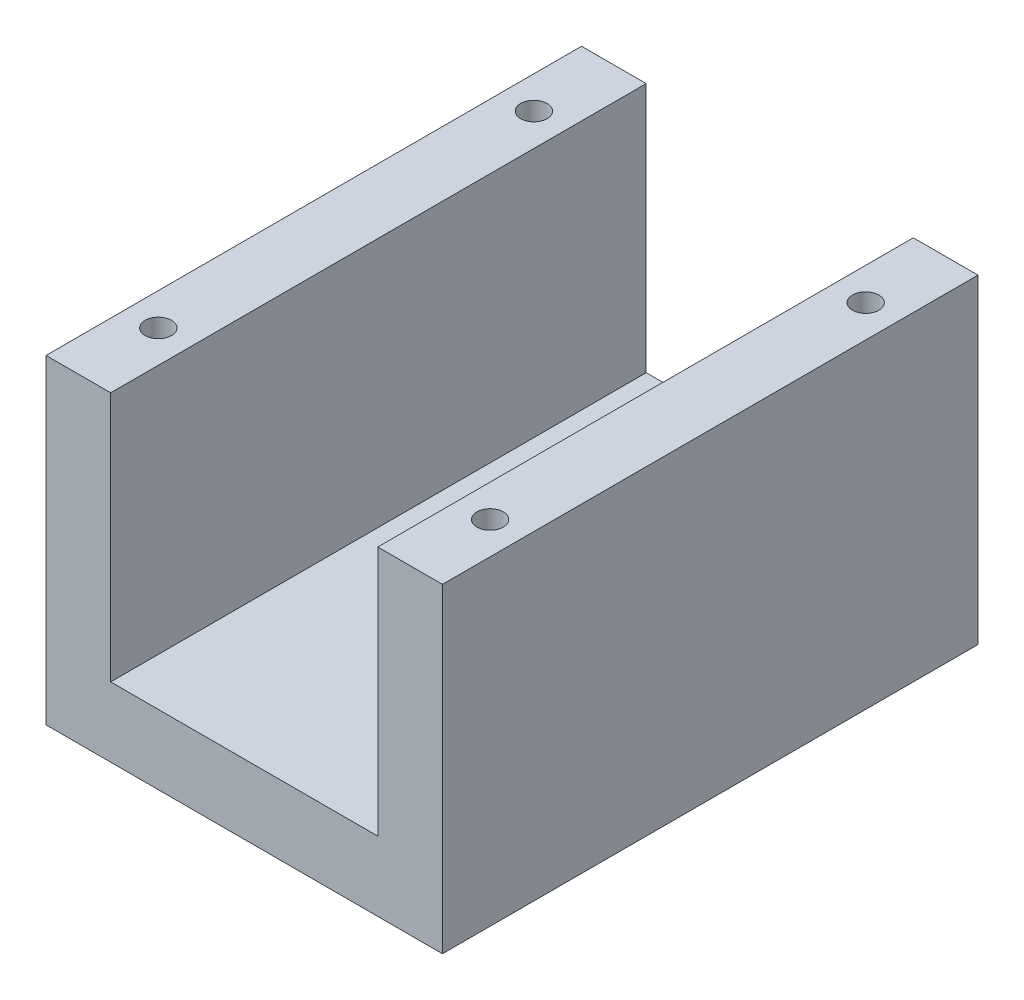
from build123d import *

# Parameters (mm, degrees)
SKETCH1_W           = 57
SKETCH1_H           = 37
BOSS_EXTRUDE1_DEPTH = 44
SKETCH2_W           = 38.4
SKETCH2_H           = 36
CUT_EXTRUDE1_DEPTH  = 47
BOSS_EXTRUDE2_DEPTH = 20
BOSS_EXTRUDE3_DEPTH = 20
SKETCH7_W           = 53
SKETCH7_H           = 31
CUT_EXTRUDE4_DEPTH  = 8
SKETCH8_R           = 1.9
CUT_EXTRUDE5_DEPTH  = 40
SKETCH10_W          = 57
SKETCH10_H          = 77
BOSS_EXTRUDE4_DEPTH = 10
SKETCH11_W          = 77
SKETCH11_H          = 8
CUT_EXTRUDE8_DEPTH  = 100


with BuildPart() as part:
    # Sketch1 → Boss-Extrude1 (new body)
    with BuildSketch(Plane(origin=(0, 0, 0), x_dir=(1, 0, 0), z_dir=(0, 1, 0))):
        Rectangle(SKETCH1_W, SKETCH1_H)
    extrude(amount=BOSS_EXTRUDE1_DEPTH)

    # Sketch2 → Cut-Extrude1 (cut)
    with BuildSketch(Plane.XY.offset(18.5)):
        with Locations((0, 18)):
            Rectangle(SKETCH2_W, SKETCH2_H)
    extrude(amount=-CUT_EXTRUDE1_DEPTH, mode=Mode.SUBTRACT)

    # Sketch5 → Boss-Extrude2 (add)
    with BuildSketch(Plane(origin=(0, 0, -18.5), x_dir=(-1, 0, 0), z_dir=(0, 0, -1))):
        Polygon((-19.2, 36), (19.2, 36), (19.2, 0), (28.5, 0), (28.5, 44), (-28.5, 44), (-28.5, 0), (-19.2, 0), align=None)
    extrude(amount=BOSS_EXTRUDE2_DEPTH)

    # Sketch6 → Boss-Extrude3 (add)
    with BuildSketch(Plane.XY.offset(18.5)):
        Polygon((-28.5, 0), (-19.2, 0), (-19.2, 36), (19.2, 36), (19.2, 0), (28.5, 0), (28.5, 44), (-28.5, 44), align=None)
    extrude(amount=BOSS_EXTRUDE3_DEPTH)

    # Sketch7 → Cut-Extrude4 (cut)
    with BuildSketch(Plane(origin=(0, 44, 0), x_dir=(1, 0, 0), z_dir=(0, 1, 0))):
        with Locations((-2, 0)):
            Rectangle(SKETCH7_W, SKETCH7_H)
    extrude(amount=-CUT_EXTRUDE4_DEPTH, mode=Mode.SUBTRACT)

    # Sketch8 → Cut-Extrude5 (cut)
    with BuildSketch(Plane(origin=(0, 44, 0), x_dir=(1, 0, 0), z_dir=(0, 1, 0))):
        with Locations((-23.85, 27)):
            Circle(SKETCH8_R)
        with Locations((23.85, 27)):
            Circle(SKETCH8_R)
        with Locations((-23.85, -27)):
            Circle(SKETCH8_R)
        with Locations((23.85, -27)):
            Circle(SKETCH8_R)
    extrude(amount=-CUT_EXTRUDE5_DEPTH, mode=Mode.SUBTRACT)

    # Sketch10 → Boss-Extrude4 (add)
    with BuildSketch(Plane.XZ):
        Rectangle(SKETCH10_W, SKETCH10_H)
    extrude(amount=BOSS_EXTRUDE4_DEPTH)

    # Sketch11 → Cut-Extrude8 (cut)
    with BuildSketch(Plane.ZY.offset(28.5)):
        with Locations((0, 40)):
            Rectangle(SKETCH11_W, SKETCH11_H)
    extrude(amount=-CUT_EXTRUDE8_DEPTH, mode=Mode.SUBTRACT)


solid = part.part
